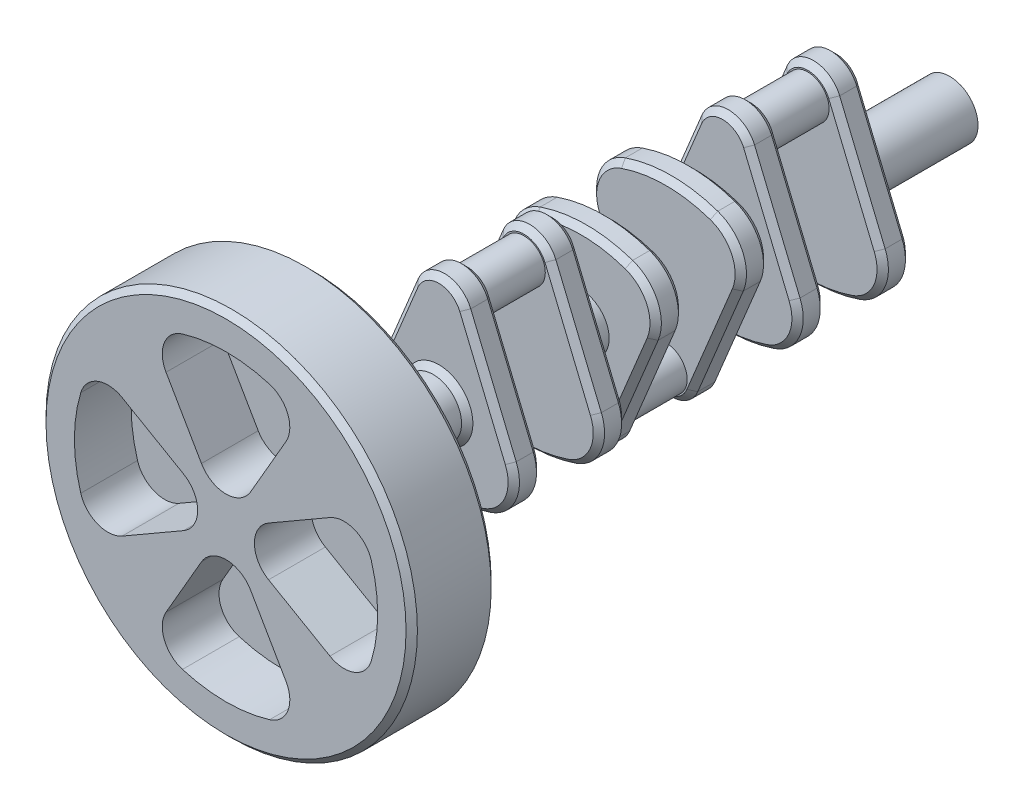
from build123d import *

# Parameters (mm, degrees)
SKETCH1_R                = 9.525
BOSS_EXTRUDE1_DEPTH      = 25.4
BOSS_EXTRUDE2_DEPTH      = 12.7
FILLET1_R                = 19.05
SKETCH3_R                = 12.7
BOSS_EXTRUDE3_DEPTH      = 12.7
LPATTERN1_COUNT          = 3
LPATTERN1_PITCH          = 63.5
BODY_MOVE_COPY1_ANGLE    = 180
LPATTERN2_COUNT          = 2
LPATTERN2_PITCH          = 63.5
SKETCH4_R                = 12.7
BOSS_EXTRUDE4_DEPTH      = 57.15
BOSS_EXTRUDE5_START      = 50.8
SKETCH5_R                = 12.7
BOSS_EXTRUDE5_DEPTH      = 50.8
SKETCH6_R                = 83.107085054
BOSS_EXTRUDE6_DEPTH      = 38.1
CHAMFER1_SIZE            = 2.54
CUT_EXTRUDE1_DEPTH       = 25.4
CIRPATTERN1_COUNT        = 4
CUT_EXTRUDE2_DEPTH       = 25.4
FILLET2_R                = 12.7
CIRPATTERN5_COUNT        = 4
FILLET2_OF_CIRPATTERN5_R = 12.7


with BuildPart() as part:
    # Sketch1 → Boss-Extrude1 (new body)
    with BuildSketch(Plane.XY):
        Circle(SKETCH1_R)
    extrude(amount=-BOSS_EXTRUDE1_DEPTH)

    # Sketch2 → Boss-Extrude2 (add)
    with BuildSketch(Plane(origin=(0, 0, -25.4), x_dir=(-1, 0, 0), z_dir=(0, 0, -1))):
        with BuildLine():
            Line((-11.733270063, 4.860079591), (-38.582444454, -59.959561363))
            ThreePointArc((-38.582444454, -59.959561363), (0, -73.025), (38.582444454, -59.959561363))
            Line((38.582444454, -59.959561363), (11.733270063, 4.860079591))
            ThreePointArc((11.733270063, 4.860079591), (0, 12.7), (-11.733270063, 4.860079591))
        make_face()
    extrude(amount=BOSS_EXTRUDE2_DEPTH)

    # Fillet1
    fillet1_edges = [part.edges().sort_by_distance(p)[0] for p in [
        (38.582444454, -59.959561363, -31.75),
        (-38.582444454, -59.959561363, -31.75),
    ]]
    fillet(fillet1_edges, radius=FILLET1_R)

    # Mirror2: part across plane


with BuildPart() as part_1:
    add(part.part)
    add(part.part.mirror(Plane.XY.offset(-12.7)))


with BuildPart() as body_2:
    # Sketch3 → Boss-Extrude3 (new body)
    with BuildSketch(Plane(origin=(0, 0, -38.1), x_dir=(-1, 0, 0), z_dir=(0, 0, -1))):
        with Locations((0, -36.591405722)):
            Circle(SKETCH3_R)
    boss_extrude3 = extrude(amount=BOSS_EXTRUDE3_DEPTH)


with BuildPart() as lpattern1_1:
    # LPattern1: pattern copy
    add(part_1.part.moved(Location(Vector(0, 0, -1) * (1 * LPATTERN1_PITCH))))


with BuildPart() as lpattern1_2:
    # LPattern1: pattern copy
    add(part_1.part.moved(Location(Vector(0, 0, -1) * (2 * LPATTERN1_PITCH))))

    # Sketch5 → Boss-Extrude5 (add)
    with BuildSketch(Plane(origin=(0, 0, -165.1), x_dir=(-1, 0, 0), z_dir=(0, 0, -1)).offset(BOSS_EXTRUDE5_START)):
        with Locations((0, -36.591405722)):
            Circle(SKETCH5_R)
    extrude(amount=-BOSS_EXTRUDE5_DEPTH)


with BuildPart() as lpattern1_1_1:
    # Body-Move/Copy1: moved
    add(lpattern1_1.part.rotate(Axis((0, -36.591405722, 0), (0, 0, 1)), BODY_MOVE_COPY1_ANGLE))


with BuildPart() as lpattern2_1:
    # LPattern2: Boss-Extrude3 ×2
    with Locations(*[(0, 0, -i * LPATTERN2_PITCH) for i in range(1, LPATTERN2_COUNT)]):
        add(boss_extrude3)


with BuildPart() as part_2:
    add(part_1.part)

    # Sketch4 → Boss-Extrude4 (add)
    with BuildSketch(Plane.XY.offset(12.7)):
        with Locations((0, -36.591405722)):
            Circle(SKETCH4_R)
    extrude(amount=BOSS_EXTRUDE4_DEPTH)

    # Sketch6 → Boss-Extrude6 (add)
    with BuildSketch(Plane.XY.offset(69.85)):
        with Locations((0, -36.591405722)):
            Circle(SKETCH6_R)
    extrude(amount=BOSS_EXTRUDE6_DEPTH)


with BuildPart() as body_2_1:
    add(body_2.part)

    # Combine1: union LPattern1_1, LPattern2_1, LPattern1_2, part
    add(lpattern1_1_1.part)
    add(lpattern2_1.part)
    add(lpattern1_2.part)
    add(part_2.part)

    # Chamfer1
    chamfer1_edges = [body_2_1.edges().sort_by_distance(p)[0] for p in [
        (12.7, -36.591405722, -165.1),
        (-12.7, -36.591405722, 12.7),
        (-31.84954561, -59.372970398, -152.4),
        (-21.906444841, -19.70013693, -152.4),
        (0, -73.025, -152.4),
        (0, 12.7, -152.4),
        (31.84954561, -59.372970398, -152.4),
        (21.906444841, -19.70013693, -152.4),
        (-31.84954561, -59.372970398, -165.1),
        (-21.906444841, -19.70013693, -165.1),
        (0, -73.025, -165.1),
        (0, 12.7, -165.1),
        (31.84954561, -59.372970398, -165.1),
        (21.906444841, -19.70013693, -165.1),
        (-31.84954561, -59.372970398, -127),
        (-21.906444841, -19.70013693, -127),
        (0, -73.025, -127),
        (0, 12.7, -127),
        (31.84954561, -59.372970398, -127),
        (21.906444841, -19.70013693, -127),
        (-31.84954561, -59.372970398, -114.3),
        (-21.906444841, -19.70013693, -114.3),
        (0, -73.025, -114.3),
        (0, 12.7, -114.3),
        (31.84954561, -59.372970398, -114.3),
        (21.906444841, -19.70013693, -114.3),
        (-21.906444841, -53.482674513, -101.6),
        (-31.84954561, -13.809841046, -101.6),
        (0, -85.882811444, -101.6),
        (0, -0.157811444, -101.6),
        (21.906444841, -53.482674513, -101.6),
        (31.84954561, -13.809841046, -101.6),
        (-21.906444841, -53.482674513, -88.9),
        (0, -85.882811444, -88.9),
        (-31.84954561, -13.809841046, -88.9),
        (21.906444841, -53.482674513, -88.9),
        (0, -0.157811444, -88.9),
        (31.84954561, -13.809841046, -88.9),
        (-21.906444841, -53.482674513, -63.5),
        (0, -85.882811444, -63.5),
        (-31.84954561, -13.809841046, -63.5),
        (21.906444841, -53.482674513, -63.5),
        (0, -0.157811444, -63.5),
        (31.84954561, -13.809841046, -63.5),
        (-21.906444841, -53.482674513, -50.8),
        (-31.84954561, -13.809841046, -50.8),
        (0, -85.882811444, -50.8),
        (0, -0.157811444, -50.8),
        (21.906444841, -53.482674513, -50.8),
        (31.84954561, -13.809841046, -50.8),
        (-21.906444841, -19.70013693, -38.1),
        (0, 12.7, -38.1),
        (-31.84954561, -59.372970398, -38.1),
        (21.906444841, -19.70013693, -38.1),
        (0, -73.025, -38.1),
        (31.84954561, -59.372970398, -38.1),
        (-21.906444841, -19.70013693, -25.4),
        (-31.84954561, -59.372970398, -25.4),
        (0, 12.7, -25.4),
        (0, -73.025, -25.4),
        (21.906444841, -19.70013693, -25.4),
        (31.84954561, -59.372970398, -25.4),
        (-21.906444841, -19.70013693, 0),
        (-31.84954561, -59.372970398, 0),
        (0, 12.7, 0),
        (0, -73.025, 0),
        (21.906444841, -19.70013693, 0),
        (31.84954561, -59.372970398, 0),
        (-21.906444841, -19.70013693, 12.7),
        (0, 12.7, 12.7),
        (-31.84954561, -59.372970398, 12.7),
        (21.906444841, -19.70013693, 12.7),
        (0, -73.025, 12.7),
        (31.84954561, -59.372970398, 12.7),
        (-83.107085054, -36.591405722, 69.85),
        (-83.107085054, -36.591405722, 107.95),
    ]]
    chamfer(chamfer1_edges, length=CHAMFER1_SIZE)

    # Sketch7 → Cut-Extrude1 (cut)
    with BuildSketch(Plane(origin=(0, 0, -215.9), x_dir=(-1, 0, 0), z_dir=(0, 0, -1))):
        with BuildLine():
            Line((1.5875, -25.478905722), (-1.5875, -25.478905722))
            Line((-1.5875, -25.478905722), (-1.5875, -27.199629066))
            ThreePointArc((-1.5875, -27.199629066), (0, -46.116405722), (1.5875, -27.199629066))
            Line((1.5875, -27.199629066), (1.5875, -25.478905722))
        make_face()
    cut_extrude1 = extrude(amount=-CUT_EXTRUDE1_DEPTH, mode=Mode.SUBTRACT)

    # CirPattern1: Cut-Extrude1 ×4 about axis
    cirpattern1_axis = Axis((0, -36.591405722, -190.5), (0, 0, -1))
    for i in range(1, CIRPATTERN1_COUNT):
        add(cut_extrude1.rotate(cirpattern1_axis, i * 360 / CIRPATTERN1_COUNT), mode=Mode.SUBTRACT)

    # Sketch8 → Cut-Extrude2 (cut)
    with BuildSketch(Plane.XY.offset(107.95)):
        with BuildLine():
            Line((-10.998522628, -17.541405722), (-33.933542527, 22.183214016))
            ThreePointArc((-33.933542527, 22.183214016), (0, 31.275679332), (33.933542527, 22.183214016))
            Line((33.933542527, 22.183214016), (10.998522628, -17.541405722))
            ThreePointArc((10.998522628, -17.541405722), (0, -23.891405722), (-10.998522628, -17.541405722))
        make_face()
    cut_extrude2 = extrude(amount=-CUT_EXTRUDE2_DEPTH, mode=Mode.SUBTRACT)

    # Fillet2
    fillet2_edges = [body_2_1.edges().sort_by_distance(p)[0] for p in [
        (-33.933542527, 22.183214016, 95.25),
        (33.933542527, 22.183214016, 95.25),
    ]]
    fillet(fillet2_edges, radius=FILLET2_R)

    # CirPattern5: Cut-Extrude2 ×4 about axis
    cirpattern5_axis = Axis((0, -36.591405722, 107.95), (0, 0, -1))
    for i in range(1, CIRPATTERN5_COUNT):
        add(cut_extrude2.rotate(cirpattern5_axis, i * 360 / CIRPATTERN5_COUNT), mode=Mode.SUBTRACT)

    # Fillet2 of CirPattern5
    fillet2_of_cirpattern5_edges = [body_2_1.edges().sort_by_distance(p)[0] for p in [
        (58.774619738, -2.657863195, 95.25),
        (58.774619738, -70.524948249, 95.25),
        (33.933542527, -95.36602546, 95.25),
        (-33.933542527, -95.36602546, 95.25),
        (-58.774619738, -70.524948249, 95.25),
        (-58.774619738, -2.657863195, 95.25),
    ]]
    fillet(fillet2_of_cirpattern5_edges, radius=FILLET2_OF_CIRPATTERN5_R)


solid = body_2_1.part
